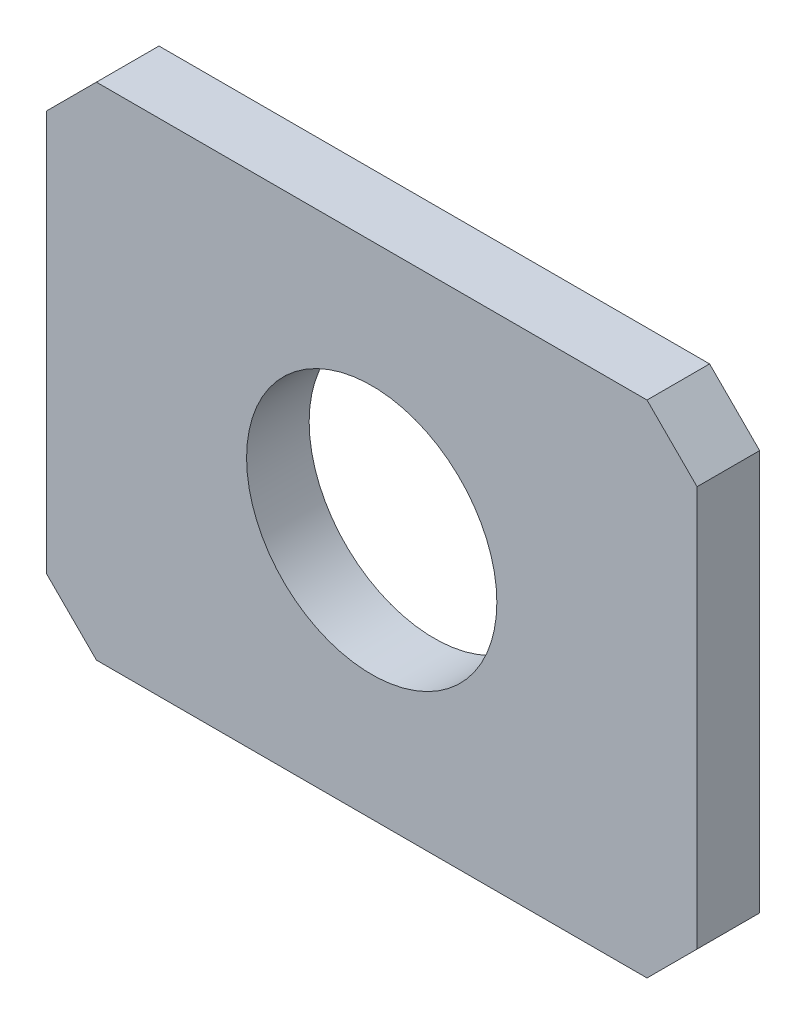
from build123d import *

# Parameters (mm, degrees)
SKETCH1_W           = 156
SKETCH1_H           = 120
BOSS_EXTRUDE1_DEPTH = 15
SKETCH2_R           = 30
CUT_EXTRUDE1_DEPTH  = 15
CHAMFER1_SIZE       = 12


with BuildPart() as part:
    # Sketch1 → Boss-Extrude1 (new body)
    with BuildSketch(Plane.XY):
        Rectangle(SKETCH1_W, SKETCH1_H)
    extrude(amount=BOSS_EXTRUDE1_DEPTH)

    # Sketch2 → Cut-Extrude1 (cut)
    with BuildSketch(Plane.XY.offset(15)):
        Circle(SKETCH2_R)
    extrude(amount=-CUT_EXTRUDE1_DEPTH, mode=Mode.SUBTRACT)

    # Chamfer1
    chamfer1_edges = [part.edges().sort_by_distance(p)[0] for p in [
        (78, -60, 7.5),
        (-78, -60, 7.5),
        (-78, 60, 7.5),
        (78, 60, 7.5),
    ]]
    chamfer(chamfer1_edges, length=CHAMFER1_SIZE)


solid = part.part
